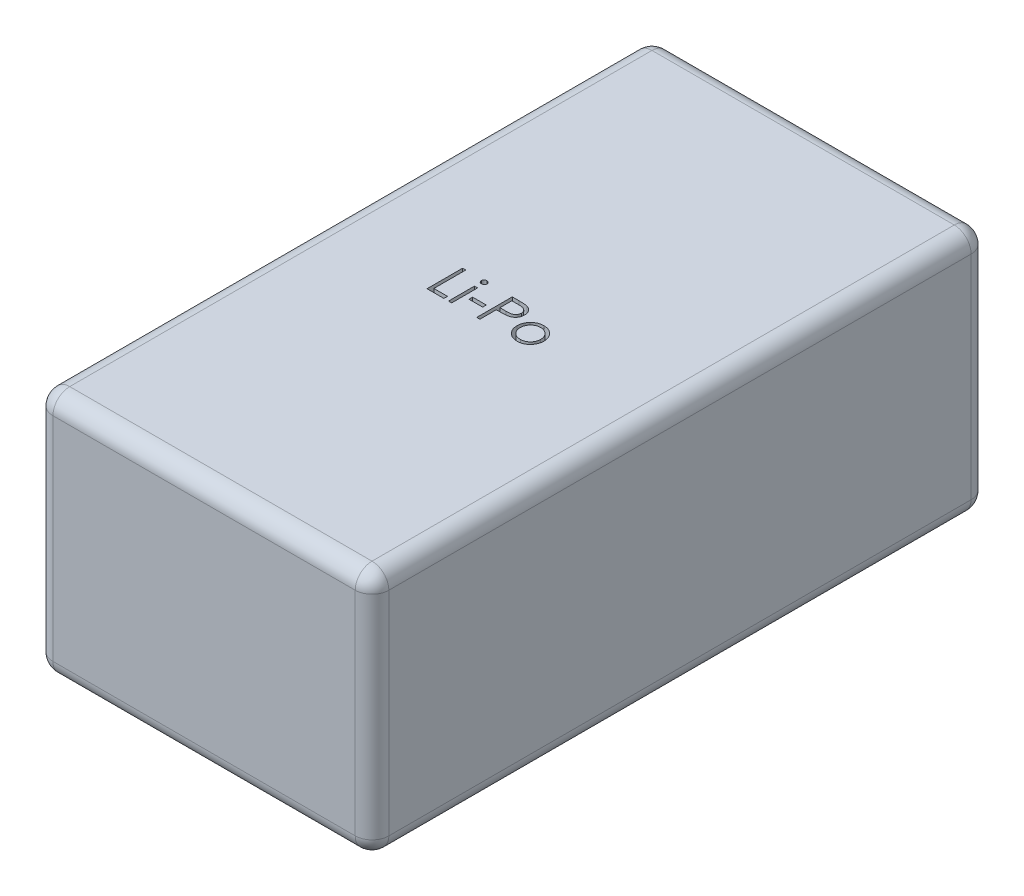
from build123d import *

# Parameters (mm, degrees)
SKETCH2_W           = 30
SKETCH2_H           = 22
BOSS_EXTRUDE1_DEPTH = 55
FILLET1_R           = 1.5
SKETCH3_W           = 0.284935897
SKETCH3_H           = 2.320192308
SKETCH3_W_2         = 1.221153846
SKETCH3_H_2         = 0.325641025
CUT_EXTRUDE1_DEPTH  = 10
SKETCH4_W           = 0.284935897
SKETCH4_H           = 2.320192308
SKETCH4_W_2         = 1.221153846
SKETCH4_H_2         = 0.325641025
CUT_EXTRUDE2_DEPTH  = 10


with BuildPart() as part:
    # Sketch2 → Boss-Extrude1 (new body)
    with BuildSketch(Plane.XY):
        with Locations((15, 11)):
            Rectangle(SKETCH2_W, SKETCH2_H)
    extrude(amount=-BOSS_EXTRUDE1_DEPTH)

    # Fillet1
    fillet1_edges = [part.edges().sort_by_distance(p)[0] for p in [
        (30, 11, -55),
        (15, 22, -55),
        (0, 11, -55),
        (15, 22, 0),
        (30, 11, 0),
        (15, 0, 0),
        (0, 11, 0),
        (15, 0, -55),
        (0, 22, -27.5),
        (30, 22, -27.5),
        (30, 0, -27.5),
        (0, 0, -27.5),
    ]]
    fillet(fillet1_edges, radius=FILLET1_R)

    # Sketch3 → Cut-Extrude1 (cut)
    # profile 1 of 6: a face of its own
    with BuildSketch(Plane(origin=(0, 22, 0), x_dir=(1, 0, 0), z_dir=(0, 1, 0))):
        Polygon((9.885208126, 28.202532915), (10.170144024, 28.202532915), (10.170144024, 25.353173941), (11.39129787, 25.353173941), (11.39129787, 25.027532915), (9.885208126, 25.027532915), align=None)
    # profile 2 of 6: a face of its own
    with BuildSketch(Plane(origin=(0, 22, 0), x_dir=(1, 0, 0), z_dir=(0, 1, 0))):
        with BuildLine():
            add(Edge.make_bspline(
                [(11.939545065, 28.3246483), (11.957226473, 28.323828104), (11.991850066, 28.322222004), (12.041918244, 28.308468379), (12.087508534, 28.285155093), (12.127946906, 28.253877096), (12.162646832, 28.217092958), (12.186940762, 28.174220509), (12.202554864, 28.127903029), (12.20444041, 28.095595055), (12.205400434, 28.079145495)],
                knots=[0, 0, 0, 0, 1.055194115, 2.066272739, 3.074728998, 4.095836921, 5.109056067, 6.073838105, 7.019297344, 8, 8, 8, 8], degree=3))
            add(Edge.make_bspline(
                [(12.205400434, 28.079145495), (12.20441876, 28.063122946), (12.202478108, 28.031448261), (12.186952822, 27.985933754), (12.162439792, 27.943657012), (12.127969157, 27.906944296), (12.087502638, 27.875683591), (12.041919811, 27.85236572), (11.991849654, 27.83861331), (11.957226334, 27.837007042), (11.939545065, 27.836186761)],
                knots=[0, 0, 0, 0, 0.96129708, 1.900370562, 2.859976407, 3.87933698, 4.906634145, 5.921202961, 6.938410037, 8, 8, 8, 8], degree=3))
            add(Edge.make_bspline(
                [(11.939545065, 27.836186761), (11.922065987, 27.836975722), (11.888045245, 27.83851133), (11.838726752, 27.852635561), (11.793525194, 27.87569157), (11.753007955, 27.906739609), (11.719234852, 27.94388248), (11.694652799, 27.985907954), (11.67916337, 28.03145483), (11.677217885, 28.063125152), (11.676233767, 28.079145495)],
                knots=[0, 0, 0, 0, 1.054934014, 2.053291228, 3.073705704, 4.106921865, 5.123545215, 6.088680038, 7.033164197, 8, 8, 8, 8], degree=3))
            add(Edge.make_bspline(
                [(11.676233767, 28.079145495), (11.677196324, 28.095592766), (11.679086847, 28.127896244), (11.69466441, 28.174246738), (11.719030093, 28.216865671), (11.753030318, 28.25408166), (11.793519243, 28.285147162), (11.83872829, 28.308198552), (11.888044839, 28.322323981), (11.922065849, 28.323859424), (11.939545065, 28.3246483)],
                knots=[0, 0, 0, 0, 0.98631895, 1.937192651, 2.907499808, 3.917963147, 4.944918757, 5.95915025, 6.951458133, 8, 8, 8, 8], degree=3))
        make_face()
    # profile 3 of 6: a face of its own
    with BuildSketch(Plane(origin=(0, 22, 0), x_dir=(1, 0, 0), z_dir=(0, 1, 0))):
        with Locations((11.940817101, 26.187629069)):
            Rectangle(SKETCH3_W, SKETCH3_H)
    # profile 4 of 6: a face of its own
    with BuildSketch(Plane(origin=(0, 22, 0), x_dir=(1, 0, 0), z_dir=(0, 1, 0))):
        with Locations((13.182323511, 26.248686762)):
            Rectangle(SKETCH3_W_2, SKETCH3_H_2)
    # profile 5 of 6: a face of its own
    with BuildSketch(Plane(origin=(0, 22, 0), x_dir=(1, 0, 0), z_dir=(0, 1, 0))):
        with BuildLine():
            Line((14.322067101, 28.202532915), (14.944728359, 28.202532915))
            add(Edge.make_bspline(
                [(14.944728359, 28.202532915), (14.987555395, 28.202485838), (15.069613898, 28.202395636), (15.187283985, 28.199660831), (15.294154241, 28.196008046), (15.38999423, 28.190944471), (15.475098833, 28.184960421), (15.549082955, 28.1765675), (15.612528123, 28.167804232), (15.65054326, 28.158894813), (15.667880402, 28.154831593)],
                knots=[0, 0, 0, 0, 1.415646017, 2.712440637, 3.8905458, 4.950247383, 5.884950622, 6.709939814, 7.411656543, 8, 8, 8, 8], degree=3))
            add(Edge.make_bspline(
                [(15.667880402, 28.154831593), (15.689827393, 28.148824539), (15.733204222, 28.136951978), (15.795707312, 28.113172386), (15.855174014, 28.084976422), (15.911808357, 28.052841848), (15.964914389, 28.015389944), (16.015284441, 27.974138876), (16.062473994, 27.928136239), (16.106217685, 27.877897996), (16.146390323, 27.82426752), (16.180979392, 27.766444212), (16.209941948, 27.705401386), (16.234782488, 27.641181504), (16.252660871, 27.573245282), (16.26612913, 27.502064764), (16.274677707, 27.427647581), (16.275496459, 27.376793273), (16.275913254, 27.350905311)],
                knots=[0, 0, 0, 0, 0.999701418, 1.975846123, 2.934577507, 3.890451536, 4.834027766, 5.787354733, 6.749476667, 7.726910423, 8.712836071, 9.690891519, 10.682875813, 11.679750201, 12.712814741, 13.765529915, 14.8625177, 16, 16, 16, 16], degree=3))
            add(Edge.make_bspline(
                [(16.275913254, 27.350905311), (16.275530962, 27.324799756), (16.274782981, 27.273722476), (16.265805636, 27.198998589), (16.253713248, 27.127589764), (16.235119494, 27.059654334), (16.210766633, 26.995595742), (16.182198842, 26.934435053), (16.147742354, 26.877212779), (16.108150259, 26.82372118), (16.064107026, 26.773910045), (16.015799004, 26.728140338), (15.963421217, 26.686679974), (15.907140126, 26.649436005), (15.846407049, 26.617272095), (15.782143095, 26.588463682), (15.713789684, 26.56426922), (15.666488975, 26.55154195), (15.642439697, 26.545070976)],
                knots=[0, 0, 0, 0, 1.121902311, 2.195077645, 3.232258892, 4.234102512, 5.217864754, 6.176164875, 7.132989551, 8.084763148, 9.034132444, 9.988522005, 10.94243251, 11.903244335, 12.886203696, 13.894208494, 14.929344452, 16, 16, 16, 16], degree=3))
            add(Edge.make_bspline(
                [(15.642439697, 26.545070976), (15.622548472, 26.540840986), (15.578955697, 26.531570717), (15.507161942, 26.521221617), (15.423572914, 26.512388222), (15.328302703, 26.505765047), (15.221436825, 26.50009507), (15.10291747, 26.495588299), (14.972511985, 26.493111932), (14.881551643, 26.492984213), (14.834061291, 26.492917531)],
                knots=[0, 0, 0, 0, 0.601384939, 1.31797006, 2.144135048, 3.087295005, 4.142315834, 5.309527816, 6.595305764, 8, 8, 8, 8], degree=3))
            Line((14.834061291, 26.492917531), (14.607002998, 26.492917531))
            Line((14.607002998, 26.492917531), (14.607002998, 25.027532915))
            Line((14.607002998, 25.027532915), (14.322067101, 25.027532915))
            Line((14.322067101, 25.027532915), (14.322067101, 28.202532915))
        make_face()
        with BuildLine():
            Line((14.607002998, 27.87689189), (14.607002998, 26.818558556))
            Line((14.607002998, 26.818558556), (15.162882405, 26.811562362))
            add(Edge.make_bspline(
                [(15.162882405, 26.811562362), (15.190024052, 26.811548335), (15.242420442, 26.811521255), (15.318109016, 26.815136422), (15.388330298, 26.819309762), (15.452868591, 26.825420207), (15.511752989, 26.834057347), (15.565081676, 26.842776567), (15.61244114, 26.855390717), (15.667866844, 26.872375216), (15.729628166, 26.90134266), (15.796818014, 26.943388632), (15.853759903, 26.996983274), (15.903034358, 27.057242807), (15.942137547, 27.124279874), (15.97076334, 27.196006695), (15.987582819, 27.271687673), (15.989838152, 27.32347477), (15.990977357, 27.349633276)],
                knots=[0, 0, 0, 0, 1.160613943, 2.240541288, 3.23993089, 4.169200891, 5.011653406, 5.7853311, 6.478053781, 7.106038997, 8.262395093, 9.384106736, 10.481365981, 11.59014053, 12.70357646, 13.786202915, 14.881775077, 16, 16, 16, 16], degree=3))
            add(Edge.make_bspline(
                [(15.990977357, 27.349633276), (15.989831956, 27.375158927), (15.987555041, 27.425900763), (15.970631508, 27.50026721), (15.942193202, 27.571238171), (15.902771863, 27.637435184), (15.854928123, 27.697477885), (15.799320862, 27.749635993), (15.736080975, 27.79156568), (15.677254366, 27.818628729), (15.625001861, 27.835152586), (15.579615726, 27.846713977), (15.528370614, 27.855944705), (15.471249843, 27.863419111), (15.408696143, 27.869817608), (15.340172101, 27.874159173), (15.265937296, 27.876700494), (15.214401992, 27.876826547), (15.187687092, 27.87689189)],
                knots=[0, 0, 0, 0, 1.120700087, 2.227813068, 3.331159281, 4.466773991, 5.599788987, 6.693661531, 7.80175334, 8.91857717, 9.525282508, 10.207424825, 10.974604443, 11.810962634, 12.737642355, 13.736264703, 14.826523623, 16, 16, 16, 16], degree=3))
            Line((15.187687092, 27.87689189), (14.607002998, 27.87689189))
        make_face(mode=Mode.SUBTRACT)
    # profile 6 of 6: a face of its own
    with BuildSketch(Plane(origin=(0, 22, 0), x_dir=(1, 0, 0), z_dir=(0, 1, 0))):
        with BuildLine():
            add(Edge.make_bspline(
                [(17.96644811, 27.388430351), (18.00998305, 27.38750335), (18.095344429, 27.385685727), (18.220355868, 27.366259294), (18.339686099, 27.336552756), (18.453792145, 27.295484982), (18.561212641, 27.240437784), (18.66351227, 27.174752213), (18.760410556, 27.096935146), (18.81848859, 27.036738898), (18.847968543, 27.006183757)],
                knots=[0, 0, 0, 0, 1.054011418, 2.066658804, 3.057071809, 4.030435133, 4.997543892, 5.974964718, 6.972108034, 8, 8, 8, 8], degree=3))
            add(Edge.make_bspline(
                [(18.847968543, 27.006183757), (18.873352173, 26.97696107), (18.923628189, 26.919081235), (18.988094948, 26.825232214), (19.043631649, 26.728040837), (19.088138764, 26.626216477), (19.123231607, 26.520648025), (19.148146917, 26.410972629), (19.162966851, 26.2974325), (19.164965256, 26.220321876), (19.165977357, 26.181268893)],
                knots=[0, 0, 0, 0, 1.025258237, 2.030674902, 3.01204498, 3.988269485, 4.97094183, 5.956517959, 6.965070386, 8, 8, 8, 8], degree=3))
            add(Edge.make_bspline(
                [(19.165977357, 26.181268893), (19.165087144, 26.141989555), (19.163328041, 26.064371751), (19.146687761, 25.950054183), (19.12080599, 25.839206023), (19.083765679, 25.732291351), (19.036269395, 25.628983357), (18.978311414, 25.529733266), (18.909485018, 25.43434526), (18.831467107, 25.343629306), (18.745241476, 25.260021383), (18.651700399, 25.187152167), (18.552682097, 25.124721213), (18.446869912, 25.074432464), (18.335230121, 25.034781522), (18.217521923, 25.006932221), (18.093928181, 24.990094122), (18.009539201, 24.987931881), (17.96644811, 24.986827787)],
                knots=[0, 0, 0, 0, 0.998656419, 1.973391657, 2.932242238, 3.890759089, 4.846373663, 5.82037756, 6.809684879, 7.83454468, 8.860553229, 9.859544525, 10.845671541, 11.83227036, 12.833544569, 13.85385346, 14.904124723, 16, 16, 16, 16], degree=3))
            add(Edge.make_bspline(
                [(17.96644811, 24.986827787), (17.9231459, 24.987935586), (17.838336335, 24.990105268), (17.714306337, 25.006866803), (17.596387182, 25.034768687), (17.48460124, 25.07456277), (17.378334128, 25.12472282), (17.278742092, 25.186963424), (17.185125026, 25.260042993), (17.098881154, 25.343623451), (17.020868134, 25.434346768), (16.952040476, 25.529732875), (16.894082823, 25.628983459), (16.846586452, 25.732291323), (16.809546165, 25.83920603), (16.783664388, 25.950054181), (16.767024109, 26.064371752), (16.765265006, 26.141989555), (16.764374793, 26.181268893)],
                knots=[0, 0, 0, 0, 1.099876186, 2.154163076, 3.173186993, 4.173200201, 5.163417411, 6.152872554, 7.150605724, 8.17532212, 9.198891216, 10.186952605, 11.159729845, 12.11414092, 13.071450619, 14.029093627, 15.002601286, 16, 16, 16, 16], degree=3))
            add(Edge.make_bspline(
                [(16.764374793, 26.181268893), (16.765393796, 26.220109617), (16.767411247, 26.297007575), (16.78221628, 26.410334265), (16.807034399, 26.51982404), (16.842169308, 26.624985007), (16.88708666, 26.726363153), (16.941842971, 26.823794678), (17.006967331, 26.917219325), (17.057043387, 26.975024355), (17.082383607, 27.004275704)],
                knots=[0, 0, 0, 0, 1.031353054, 2.041901799, 3.029428768, 4.008703097, 4.981709435, 5.96992636, 6.972712378, 8, 8, 8, 8], degree=3))
            add(Edge.make_bspline(
                [(17.082383607, 27.004275704), (17.111819114, 27.035095827), (17.16970922, 27.095709023), (17.267089851, 27.173299241), (17.369137817, 27.24035168), (17.477745429, 27.294305104), (17.591757736, 27.336794331), (17.711699477, 27.366335905), (17.837135123, 27.385615734), (17.922914208, 27.387482795), (17.96644811, 27.388430351)],
                knots=[0, 0, 0, 0, 1.027980169, 2.021703884, 2.998553061, 3.971491411, 4.943284454, 5.930300938, 6.949603206, 8, 8, 8, 8], degree=3))
        make_face()
        with BuildLine():
            add(Edge.make_bspline(
                [(17.965176075, 27.103494454), (17.934389813, 27.102619431), (17.873612032, 27.100891975), (17.78414998, 27.087753004), (17.698025698, 27.06693634), (17.615075789, 27.037359803), (17.535579983, 26.999170088), (17.459462168, 26.952263218), (17.386498454, 26.897260465), (17.318116154, 26.834247898), (17.255357914, 26.76541481), (17.200495749, 26.692073799), (17.153845831, 26.615414471), (17.114983687, 26.535357108), (17.086039309, 26.451090418), (17.065018068, 26.363568703), (17.051891492, 26.272613646), (17.050180277, 26.210781865), (17.04931069, 26.17936084)],
                knots=[0, 0, 0, 0, 1.021534396, 2.016698045, 2.994645724, 3.958388632, 4.93408049, 5.916473867, 6.921342795, 7.962252576, 8.998418191, 10.008913653, 10.997312074, 11.973003931, 12.956656626, 13.948281152, 14.957379055, 16, 16, 16, 16], degree=3))
            add(Edge.make_bspline(
                [(17.04931069, 26.17936084), (17.050768309, 26.138764358), (17.053661409, 26.058187933), (17.077188374, 25.939523558), (17.116545928, 25.825602877), (17.16969296, 25.717093727), (17.236282887, 25.616698161), (17.314739012, 25.527189029), (17.404219311, 25.449913328), (17.503657136, 25.385795704), (17.61102141, 25.334850783), (17.724646787, 25.298747426), (17.84315656, 25.275278105), (17.924146937, 25.272945411), (17.965176075, 25.271763684)],
                knots=[0, 0, 0, 0, 1.016792936, 2.018143844, 3.017858371, 4.030088057, 5.03801393, 6.028138512, 7.003788237, 7.991172063, 8.984598303, 9.972568034, 10.972917682, 12, 12, 12, 12], degree=3))
            add(Edge.make_bspline(
                [(17.965176075, 25.271763684), (18.006202852, 25.272952296), (18.087188572, 25.275298582), (18.205533682, 25.298629225), (18.318848499, 25.335008975), (18.426101258, 25.385738408), (18.52549382, 25.450156813), (18.615617665, 25.526752669), (18.693403906, 25.616935234), (18.759927961, 25.717226707), (18.813945364, 25.825434655), (18.853118697, 25.939544583), (18.876702221, 26.058182578), (18.879587687, 26.138762564), (18.881041459, 26.17936084)],
                knots=[0, 0, 0, 0, 1.02726834, 2.027799167, 3.010890988, 4.004497153, 4.992059811, 5.971914811, 6.958719428, 7.966827853, 8.981595046, 9.981490638, 10.983022906, 12, 12, 12, 12], degree=3))
            add(Edge.make_bspline(
                [(18.881041459, 26.17936084), (18.880172172, 26.210782053), (18.878461546, 26.272614203), (18.865330685, 26.363566572), (18.844325303, 26.451098235), (18.815322479, 26.535328266), (18.776629195, 26.615621752), (18.729079675, 26.691848719), (18.674441531, 26.765668871), (18.610926, 26.834025388), (18.542615078, 26.897285029), (18.469621794, 26.952284546), (18.393616849, 26.998963937), (18.314351992, 27.037686455), (18.231391448, 27.066667256), (18.145387838, 27.087873201), (18.056307489, 27.10083645), (17.9957475, 27.102602786), (17.965176075, 27.103494454)],
                knots=[0, 0, 0, 0, 1.042956736, 2.052379634, 3.044323526, 4.02829302, 5.004299113, 5.996692471, 7.007513377, 8.048758398, 9.090003419, 10.095195979, 11.07790575, 12.047570684, 13.018257071, 13.989683339, 14.985167495, 16, 16, 16, 16], degree=3))
        make_face(mode=Mode.SUBTRACT)
    extrude(amount=-CUT_EXTRUDE1_DEPTH, mode=Mode.SUBTRACT)

    # Sketch4 → Cut-Extrude2 (cut)
    # profile 1 of 6: a face of its own
    with BuildSketch(Plane.XZ):
        Polygon((10.929138673, -26.028255103), (11.21407457, -26.028255103), (11.21407457, -28.877614077), (12.435228417, -28.877614077), (12.435228417, -29.203255103), (10.929138673, -29.203255103), align=None)
    # profile 2 of 6: a face of its own
    with BuildSketch(Plane.XZ):
        with BuildLine():
            add(Edge.make_bspline(
                [(12.983475612, -25.906139718), (13.00115702, -25.906959914), (13.035780613, -25.908566014), (13.085848791, -25.922319639), (13.131439081, -25.945632925), (13.171877453, -25.976910922), (13.206577378, -26.01369506), (13.230871309, -26.056567509), (13.246485411, -26.102884989), (13.248370957, -26.135192963), (13.249330981, -26.151642523)],
                knots=[0, 0, 0, 0, 1.055194115, 2.066272739, 3.074728998, 4.095836921, 5.109056067, 6.073838105, 7.019297344, 8, 8, 8, 8], degree=3))
            add(Edge.make_bspline(
                [(13.249330981, -26.151642523), (13.248349307, -26.167665072), (13.246408655, -26.199339757), (13.230883369, -26.244854264), (13.206370339, -26.287131006), (13.171899704, -26.323843722), (13.131433185, -26.355104427), (13.085850357, -26.378422298), (13.035780201, -26.392174708), (13.001156881, -26.393780976), (12.983475612, -26.394601257)],
                knots=[0, 0, 0, 0, 0.96129708, 1.900370562, 2.859976407, 3.87933698, 4.906634145, 5.921202961, 6.938410037, 8, 8, 8, 8], degree=3))
            add(Edge.make_bspline(
                [(12.983475612, -26.394601257), (12.965996534, -26.393812296), (12.931975792, -26.392276688), (12.882657299, -26.378152457), (12.837455741, -26.355096448), (12.796938502, -26.324048409), (12.763165398, -26.286905538), (12.738583346, -26.244880064), (12.723093916, -26.199333188), (12.721148432, -26.167662866), (12.720164314, -26.151642523)],
                knots=[0, 0, 0, 0, 1.054934014, 2.053291228, 3.073705704, 4.106921865, 5.123545215, 6.088680038, 7.033164197, 8, 8, 8, 8], degree=3))
            add(Edge.make_bspline(
                [(12.720164314, -26.151642523), (12.721126871, -26.135195252), (12.723017394, -26.102891775), (12.738594957, -26.05654128), (12.762960639, -26.013922347), (12.796960865, -25.976706358), (12.83744979, -25.945640856), (12.882658837, -25.922589466), (12.931975386, -25.908464037), (12.965996396, -25.906928594), (12.983475612, -25.906139718)],
                knots=[0, 0, 0, 0, 0.98631895, 1.937192651, 2.907499808, 3.917963147, 4.944918757, 5.95915025, 6.951458133, 8, 8, 8, 8], degree=3))
        make_face()
    # profile 3 of 6: a face of its own
    with BuildSketch(Plane.XZ):
        with Locations((12.984747648, -28.043158949)):
            Rectangle(SKETCH4_W, SKETCH4_H)
    # profile 4 of 6: a face of its own
    with BuildSketch(Plane.XZ):
        with Locations((14.226254058, -27.982101257)):
            Rectangle(SKETCH4_W_2, SKETCH4_H_2)
    # profile 5 of 6: a face of its own
    with BuildSketch(Plane.XZ):
        with BuildLine():
            Line((15.365997647, -26.028255103), (15.988658905, -26.028255103))
            add(Edge.make_bspline(
                [(15.988658905, -26.028255103), (16.031485942, -26.02830218), (16.113544445, -26.028392382), (16.231214531, -26.031127187), (16.338084788, -26.034779972), (16.433924776, -26.039843547), (16.51902938, -26.045827597), (16.593013501, -26.054220518), (16.65645867, -26.062983786), (16.694473807, -26.071893205), (16.711810949, -26.075956425)],
                knots=[0, 0, 0, 0, 1.415646017, 2.712440637, 3.8905458, 4.950247383, 5.884950622, 6.709939814, 7.411656543, 8, 8, 8, 8], degree=3))
            add(Edge.make_bspline(
                [(16.711810949, -26.075956425), (16.73375794, -26.081963479), (16.777134769, -26.09383604), (16.839637858, -26.117615632), (16.899104561, -26.145811596), (16.955738903, -26.17794617), (17.008844936, -26.215398074), (17.059214987, -26.256649142), (17.106404541, -26.302651779), (17.150148232, -26.352890022), (17.19032087, -26.406520498), (17.224909939, -26.464343806), (17.253872495, -26.525386632), (17.278713034, -26.589606514), (17.296591418, -26.657542736), (17.310059677, -26.728723254), (17.318608254, -26.803140437), (17.319427006, -26.853994745), (17.319843801, -26.879882707)],
                knots=[0, 0, 0, 0, 0.999701418, 1.975846123, 2.934577507, 3.890451536, 4.834027766, 5.787354733, 6.749476667, 7.726910423, 8.712836071, 9.690891519, 10.682875813, 11.679750201, 12.712814741, 13.765529915, 14.8625177, 16, 16, 16, 16], degree=3))
            add(Edge.make_bspline(
                [(17.319843801, -26.879882707), (17.319461509, -26.905988262), (17.318713528, -26.957065543), (17.309736183, -27.031789429), (17.297643795, -27.103198254), (17.279050041, -27.171133684), (17.25469718, -27.235192276), (17.226129389, -27.296352965), (17.191672901, -27.353575239), (17.152080805, -27.407066838), (17.108037573, -27.456877973), (17.059729551, -27.50264768), (17.007351764, -27.544108044), (16.951070673, -27.581352013), (16.890337595, -27.613515923), (16.826073642, -27.642324336), (16.757720231, -27.666518798), (16.710419522, -27.679246068), (16.686370244, -27.685717042)],
                knots=[0, 0, 0, 0, 1.121902311, 2.195077645, 3.232258892, 4.234102512, 5.217864754, 6.176164875, 7.132989551, 8.084763148, 9.034132444, 9.988522005, 10.94243251, 11.903244335, 12.886203696, 13.894208494, 14.929344452, 16, 16, 16, 16], degree=3))
            add(Edge.make_bspline(
                [(16.686370244, -27.685717042), (16.666479019, -27.689947032), (16.622886244, -27.699217301), (16.551092489, -27.709566401), (16.467503461, -27.718399796), (16.372233249, -27.725022971), (16.265367371, -27.730692948), (16.146848017, -27.735199719), (16.016442532, -27.737676086), (15.925482189, -27.737803805), (15.877991838, -27.737870487)],
                knots=[0, 0, 0, 0, 0.601384939, 1.31797006, 2.144135048, 3.087295005, 4.142315834, 5.309527816, 6.595305764, 8, 8, 8, 8], degree=3))
            Line((15.877991838, -27.737870487), (15.650933545, -27.737870487))
            Line((15.650933545, -27.737870487), (15.650933545, -29.203255103))
            Line((15.650933545, -29.203255103), (15.365997647, -29.203255103))
            Line((15.365997647, -29.203255103), (15.365997647, -26.028255103))
        make_face()
        with BuildLine():
            Line((15.650933545, -26.353896128), (15.650933545, -27.412229462))
            Line((15.650933545, -27.412229462), (16.206812952, -27.419225656))
            add(Edge.make_bspline(
                [(16.206812952, -27.419225656), (16.233954599, -27.419239683), (16.286350989, -27.419266764), (16.362039563, -27.415651597), (16.432260845, -27.411478256), (16.496799138, -27.405367811), (16.555683536, -27.396730671), (16.609012223, -27.388011451), (16.656371687, -27.375397301), (16.711797391, -27.358412802), (16.773558713, -27.329445358), (16.840748561, -27.287399387), (16.89769045, -27.233804744), (16.946964905, -27.173545211), (16.986068094, -27.106508144), (17.014693887, -27.034781323), (17.031513366, -26.959100345), (17.033768699, -26.907313248), (17.034907904, -26.881154742)],
                knots=[0, 0, 0, 0, 1.160613943, 2.240541288, 3.23993089, 4.169200891, 5.011653406, 5.7853311, 6.478053781, 7.106038997, 8.262395093, 9.384106736, 10.481365981, 11.59014053, 12.70357646, 13.786202915, 14.881775077, 16, 16, 16, 16], degree=3))
            add(Edge.make_bspline(
                [(17.034907904, -26.881154742), (17.033762503, -26.855629091), (17.031485588, -26.804887255), (17.014562055, -26.730520808), (16.986123749, -26.659549847), (16.94670241, -26.593352834), (16.89885867, -26.533310133), (16.843251409, -26.481152025), (16.780011522, -26.439222338), (16.721184912, -26.412159289), (16.668932408, -26.395635432), (16.623546273, -26.384074041), (16.572301161, -26.374843313), (16.51518039, -26.367368907), (16.45262669, -26.36097041), (16.384102648, -26.356628845), (16.309867843, -26.354087524), (16.258332539, -26.353961472), (16.231617639, -26.353896128)],
                knots=[0, 0, 0, 0, 1.120700087, 2.227813068, 3.331159281, 4.466773991, 5.599788987, 6.693661531, 7.80175334, 8.91857717, 9.525282508, 10.207424825, 10.974604443, 11.810962634, 12.737642355, 13.736264703, 14.826523623, 16, 16, 16, 16], degree=3))
            Line((16.231617639, -26.353896128), (15.650933545, -26.353896128))
        make_face(mode=Mode.SUBTRACT)
    # profile 6 of 6: a face of its own
    with BuildSketch(Plane.XZ):
        with BuildLine():
            add(Edge.make_bspline(
                [(19.010378657, -26.842357667), (19.053913597, -26.843284668), (19.139274976, -26.845102291), (19.264286415, -26.864528724), (19.383616646, -26.894235262), (19.497722692, -26.935303036), (19.605143188, -26.990350234), (19.707442817, -27.056035805), (19.804341103, -27.133852872), (19.862419137, -27.19404912), (19.89189909, -27.224604261)],
                knots=[0, 0, 0, 0, 1.054011418, 2.066658804, 3.057071809, 4.030435133, 4.997543892, 5.974964718, 6.972108034, 8, 8, 8, 8], degree=3))
            add(Edge.make_bspline(
                [(19.89189909, -27.224604261), (19.917282719, -27.253826949), (19.967558736, -27.311706783), (20.032025495, -27.405555804), (20.087562196, -27.502747181), (20.132069311, -27.604571541), (20.167162154, -27.710139993), (20.192077464, -27.819815389), (20.206897398, -27.933355518), (20.208895803, -28.010466143), (20.209907904, -28.049519125)],
                knots=[0, 0, 0, 0, 1.025258237, 2.030674902, 3.01204498, 3.988269485, 4.97094183, 5.956517959, 6.965070386, 8, 8, 8, 8], degree=3))
            add(Edge.make_bspline(
                [(20.209907904, -28.049519125), (20.209017691, -28.088798463), (20.207258588, -28.166416267), (20.190618307, -28.280733835), (20.164736537, -28.391581995), (20.127696226, -28.498496667), (20.080199941, -28.601804661), (20.022241961, -28.701054752), (19.953415565, -28.796442759), (19.875397654, -28.887158712), (19.789172023, -28.970766635), (19.695630946, -29.043635851), (19.596612644, -29.106066805), (19.490800459, -29.156355554), (19.379160667, -29.196006496), (19.26145247, -29.223855797), (19.137858728, -29.240693896), (19.053469748, -29.242856137), (19.010378657, -29.243960231)],
                knots=[0, 0, 0, 0, 0.998656419, 1.973391657, 2.932242238, 3.890759089, 4.846373663, 5.82037756, 6.809684879, 7.83454468, 8.860553229, 9.859544525, 10.845671541, 11.83227036, 12.833544569, 13.85385346, 14.904124723, 16, 16, 16, 16], degree=3))
            add(Edge.make_bspline(
                [(19.010378657, -29.243960231), (18.967076447, -29.242852432), (18.882266882, -29.24068275), (18.758236884, -29.223921215), (18.640317729, -29.196019331), (18.528531786, -29.156225249), (18.422264675, -29.106065198), (18.322672639, -29.043824594), (18.229055573, -28.970745025), (18.142811701, -28.887164567), (18.06479868, -28.79644125), (17.995971023, -28.701055144), (17.93801337, -28.601804559), (17.890516999, -28.498496695), (17.853476712, -28.391581988), (17.827594935, -28.280733837), (17.810954656, -28.166416267), (17.809195553, -28.088798463), (17.80830534, -28.049519125)],
                knots=[0, 0, 0, 0, 1.099876186, 2.154163076, 3.173186993, 4.173200201, 5.163417411, 6.152872554, 7.150605724, 8.17532212, 9.198891216, 10.186952605, 11.159729845, 12.11414092, 13.071450619, 14.029093627, 15.002601286, 16, 16, 16, 16], degree=3))
            add(Edge.make_bspline(
                [(17.80830534, -28.049519125), (17.809324343, -28.010678401), (17.811341793, -27.933780444), (17.826146827, -27.820453753), (17.850964946, -27.710963978), (17.886099855, -27.605803011), (17.931017207, -27.504424865), (17.985773518, -27.40699334), (18.050897878, -27.313568693), (18.100973934, -27.255763663), (18.126314154, -27.226512314)],
                knots=[0, 0, 0, 0, 1.031353054, 2.041901799, 3.029428768, 4.008703097, 4.981709435, 5.96992636, 6.972712378, 8, 8, 8, 8], degree=3))
            add(Edge.make_bspline(
                [(18.126314154, -27.226512314), (18.155749661, -27.195692191), (18.213639766, -27.135078995), (18.311020398, -27.057488777), (18.413068364, -26.990436338), (18.521675976, -26.936482914), (18.635688283, -26.893993688), (18.755630024, -26.864452113), (18.88106567, -26.845172284), (18.966844755, -26.843305223), (19.010378657, -26.842357667)],
                knots=[0, 0, 0, 0, 1.027980169, 2.021703884, 2.998553061, 3.971491411, 4.943284454, 5.930300938, 6.949603206, 8, 8, 8, 8], degree=3))
        make_face()
        with BuildLine():
            add(Edge.make_bspline(
                [(19.009106622, -27.127293564), (18.97832036, -27.128168587), (18.917542579, -27.129896043), (18.828080527, -27.143035014), (18.741956245, -27.163851678), (18.659006336, -27.193428215), (18.57951053, -27.23161793), (18.503392715, -27.2785248), (18.430429001, -27.333527553), (18.362046701, -27.39654012), (18.299288461, -27.465373208), (18.244426296, -27.538714219), (18.197776378, -27.615373547), (18.158914234, -27.69543091), (18.129969856, -27.7796976), (18.108948614, -27.867219316), (18.095822039, -27.958174372), (18.094110824, -28.020006153), (18.093241237, -28.051427178)],
                knots=[0, 0, 0, 0, 1.021534396, 2.016698045, 2.994645724, 3.958388632, 4.93408049, 5.916473867, 6.921342795, 7.962252576, 8.998418191, 10.008913653, 10.997312074, 11.973003931, 12.956656626, 13.948281152, 14.957379055, 16, 16, 16, 16], degree=3))
            add(Edge.make_bspline(
                [(18.093241237, -28.051427178), (18.094698856, -28.09202366), (18.097591956, -28.172600085), (18.121118921, -28.29126446), (18.160476474, -28.405185141), (18.213623507, -28.513694291), (18.280213434, -28.614089857), (18.358669558, -28.70359899), (18.448149858, -28.78087469), (18.547587683, -28.844992314), (18.654951957, -28.895937235), (18.768577334, -28.932040592), (18.887087107, -28.955509913), (18.968077484, -28.957842607), (19.009106622, -28.959024334)],
                knots=[0, 0, 0, 0, 1.016792936, 2.018143844, 3.017858371, 4.030088057, 5.03801393, 6.028138512, 7.003788237, 7.991172063, 8.984598303, 9.972568034, 10.972917682, 12, 12, 12, 12], degree=3))
            add(Edge.make_bspline(
                [(19.009106622, -28.959024334), (19.050133399, -28.957835722), (19.131119118, -28.955489436), (19.249464229, -28.932158793), (19.362779046, -28.895779043), (19.470031805, -28.84504961), (19.569424367, -28.780631205), (19.659548212, -28.704035349), (19.737334452, -28.613852784), (19.803858508, -28.513561311), (19.857875911, -28.405353363), (19.897049244, -28.291243435), (19.920632768, -28.17260544), (19.923518234, -28.092025454), (19.924972006, -28.051427178)],
                knots=[0, 0, 0, 0, 1.02726834, 2.027799167, 3.010890988, 4.004497153, 4.992059811, 5.971914811, 6.958719428, 7.966827853, 8.981595046, 9.981490638, 10.983022906, 12, 12, 12, 12], degree=3))
            add(Edge.make_bspline(
                [(19.924972006, -28.051427178), (19.924102719, -28.020005965), (19.922392093, -27.958173815), (19.909261232, -27.867221446), (19.88825585, -27.779689783), (19.859253026, -27.695459752), (19.820559742, -27.615166266), (19.773010222, -27.538939299), (19.718372078, -27.465119147), (19.654856547, -27.39676263), (19.586545625, -27.333502989), (19.513552341, -27.278503472), (19.437547396, -27.231824082), (19.358282539, -27.193101563), (19.275321995, -27.164120762), (19.189318385, -27.142914817), (19.100238036, -27.129951568), (19.039678047, -27.128185232), (19.009106622, -27.127293564)],
                knots=[0, 0, 0, 0, 1.042956736, 2.052379634, 3.044323526, 4.02829302, 5.004299113, 5.996692471, 7.007513377, 8.048758398, 9.090003419, 10.095195979, 11.07790575, 12.047570684, 13.018257071, 13.989683339, 14.985167495, 16, 16, 16, 16], degree=3))
        make_face(mode=Mode.SUBTRACT)
    extrude(amount=-CUT_EXTRUDE2_DEPTH, mode=Mode.SUBTRACT)


solid = part.part
